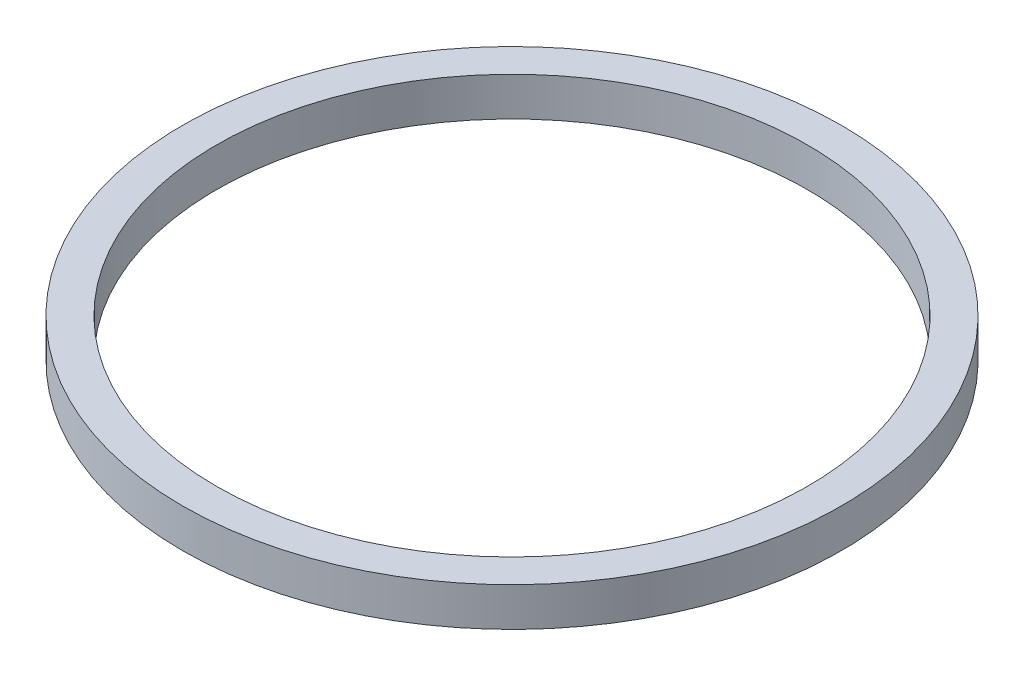
from build123d import *

# Parameters (mm, degrees)
SKETCH_1_R      = 3.4
SKETCH_1_R_2    = 3.05
EXTRUDE_1_DEPTH = 0.2


with BuildPart() as part:
    # 草图1 → 凸台-拉伸1 (new, symmetric)
    with BuildSketch(Plane(origin=(0, 0, 0), x_dir=(1, 0, 0), z_dir=(0, 1, 0))):
        with Locations(Location((0, 0, 0), (0, 0, 270))):
            Circle(SKETCH_1_R)
        with Locations(Location((0, 0, 0), (0, 0, 270))):
            Circle(SKETCH_1_R_2, mode=Mode.SUBTRACT)
    extrude(amount=EXTRUDE_1_DEPTH, both=True)


solid = part.part
